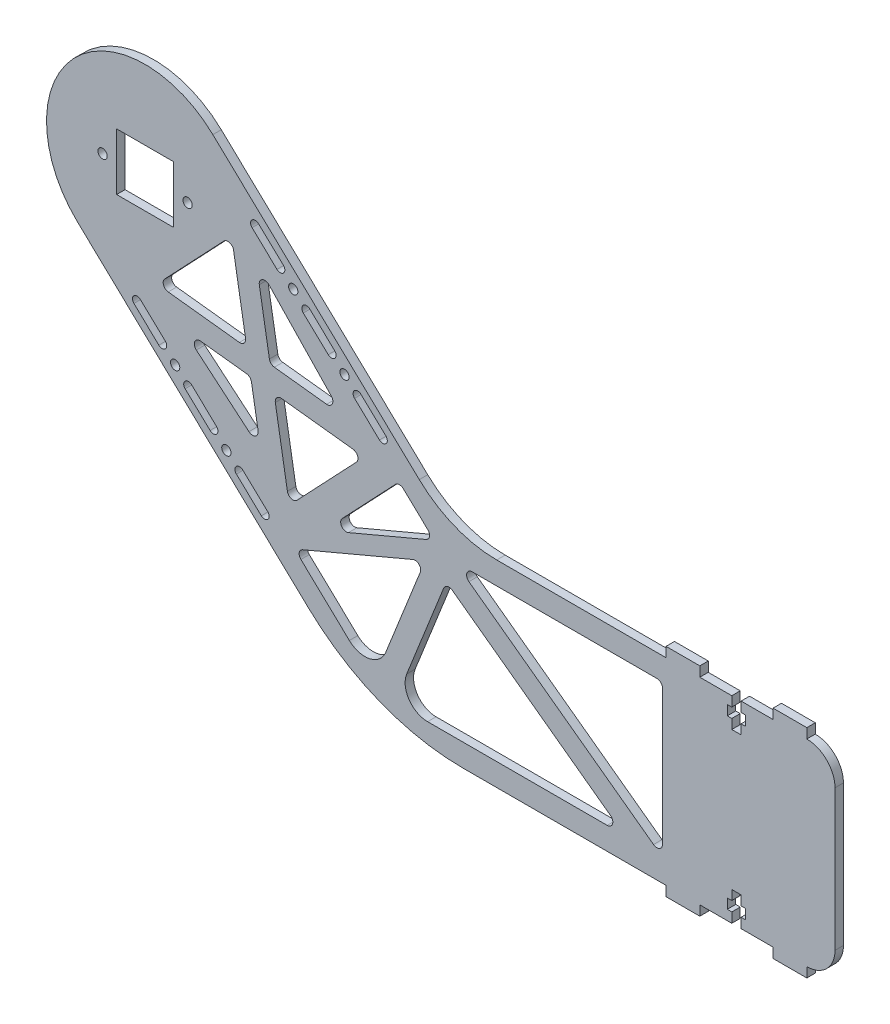
from build123d import *

# Parameters (mm, degrees)
SKETCH_1_R          = 7.65
EXTRUDE_1_DEPTH     = 3
FILLET_1_R          = 10
SKETCH_3_R          = 1.65
CUT_EXTRUDE_2_DEPTH = 276.061811235
FILLET_2_R          = 40
FILLET_3_R          = 80
SKETCH_4_W          = 12
SKETCH_4_H          = 3.5
EXTRUDE_2_DEPTH     = 3
CUT_EXTRUDE_3_DEPTH = 10
FILLET_4_R          = 2
FILLET_5_R          = 8
SKETCH_6_R          = 1.65
SKETCH_6_W          = 20.2
SKETCH_6_H          = 20.2
CUT_EXTRUDE_4_DEPTH = 277.6699297


with BuildPart() as part:
    # 草图1 → 凸台-拉伸1 (new body)
    with BuildSketch(Plane.XY):
        with BuildLine():
            Line((108.946536832, -55), (24.071062677, 25.408343937))
            ThreePointArc((24.071062677, 25.408343937), (-25.408343937, 24.071062677), (-24.071062677, -25.408343937))
            Line((-24.071062677, -25.408343937), (81.053463168, -125))
            Line((81.053463168, -125), (245, -125))
            Line((245, -125), (245, -55))
            Line((245, -55), (108.946536832, -55))
        make_face()
        Circle(SKETCH_1_R, mode=Mode.SUBTRACT)
    extrude(amount=EXTRUDE_1_DEPTH)

    # 圆角1
    fillet_1_edges = [part.edges().sort_by_distance(p)[0] for p in [
        (245, -55, 1.5),
        (245, -125, 1.5),
    ]]
    fillet(fillet_1_edges, radius=FILLET_1_R)

    # 草图3 → 切除-拉伸2 (cut, through all)
    with BuildSketch(Plane.XY.offset(3)):
        with Locations((10.675325257, -52.127223508)):
            Circle(SKETCH_3_R)
        with Locations((52.62774878, -7.84410979)):
            Circle(SKETCH_3_R)
        with Locations((70.824604166, -24.986876604)):
            Circle(SKETCH_3_R)
        with Locations((28.872180643, -69.269990322)):
            Circle(SKETCH_3_R)
        with BuildLine():
            Line((40.259807528, 6.14576259), (49.116430272, -2.244722115))
            ThreePointArc((49.116430272, -2.244722115), (49.179473531, -4.577322712), (46.846872934, -4.640365972))
            Line((46.846872934, -4.640365972), (37.99025019, 3.750118733))
            ThreePointArc((37.99025019, 3.750118733), (37.92720693, 6.08271933), (40.259807528, 6.14576259))
        make_face()
        with BuildLine():
            Line((16.504239392, -55.280117943), (25.360862135, -63.670602647))
            ThreePointArc((25.360862135, -63.670602647), (25.423905395, -66.003203245), (23.091304797, -66.066246504))
            Line((23.091304797, -66.066246504), (14.234682054, -57.6757618))
            ThreePointArc((14.234682054, -57.6757618), (14.171638794, -55.343161202), (16.504239392, -55.280117943))
        make_face()
        Polygon((208.35, -55), (208.35, -58.5), (206.75, -58.5), (206.75, -62), (208.35, -62), (208.35, -65.4), (211.65, -65.4), (211.65, -62), (213.25, -62), (213.25, -58.5), (211.65, -58.5), (211.65, -55), align=None)
        with BuildLine():
            Line((-1.692615995, -38.137351128), (7.164006749, -46.527835833))
            ThreePointArc((7.164006749, -46.527835833), (7.227050008, -48.86043643), (4.894449411, -48.92347969))
            Line((4.894449411, -48.92347969), (-3.962173333, -40.532994985))
            ThreePointArc((-3.962173333, -40.532994985), (-4.025216592, -38.200394388), (-1.692615995, -38.137351128))
        make_face()
        with BuildLine():
            Line((58.456662914, -10.997004225), (67.313285658, -19.387488929))
            ThreePointArc((67.313285658, -19.387488929), (67.376328917, -21.720089527), (65.04372832, -21.783132786))
            Line((65.04372832, -21.783132786), (56.187105576, -13.392648081))
            ThreePointArc((56.187105576, -13.392648081), (56.124062317, -11.060047484), (58.456662914, -10.997004225))
        make_face()
        with BuildLine():
            Line((34.701094778, -72.422884757), (43.557717522, -80.813369462))
            ThreePointArc((43.557717522, -80.813369462), (43.620760781, -83.145970059), (41.288160183, -83.209013319))
            Line((41.288160183, -83.209013319), (32.43153744, -74.818528614))
            ThreePointArc((32.43153744, -74.818528614), (32.36849418, -72.485928017), (34.701094778, -72.422884757))
        make_face()
        with BuildLine():
            Line((76.6535183, -28.139771039), (85.510141044, -36.530255744))
            ThreePointArc((85.510141044, -36.530255744), (85.573184303, -38.862856341), (83.240583706, -38.9258996))
            Line((83.240583706, -38.9258996), (74.383960962, -30.535414896))
            ThreePointArc((74.383960962, -30.535414896), (74.320917703, -28.202814298), (76.6535183, -28.139771039))
        make_face()
        Polygon((208.35, -125), (211.65, -125), (211.65, -121.5), (213.25, -121.5), (213.25, -118), (211.65, -118), (211.65, -114.6), (208.35, -114.6), (208.35, -118), (206.75, -118), (206.75, -121.5), (208.35, -121.5), align=None)
    extrude(amount=-CUT_EXTRUDE_2_DEPTH, mode=Mode.SUBTRACT)

    # 圆角2
    fillet_2_edges = [part.edges().sort_by_distance(p)[0] for p in [
        (108.946536832, -55, 1.5),
    ]]
    fillet(fillet_2_edges, radius=FILLET_2_R)

    # 圆角3
    fillet_3_edges = [part.edges().sort_by_distance(p)[0] for p in [
        (81.053463168, -125, 1.5),
    ]]
    fillet(fillet_3_edges, radius=FILLET_3_R)

    # 草图4 → 凸台-拉伸2 (add)
    with BuildSketch(Plane.XY.offset(3)):
        with Locations((229, -53.25)):
            Rectangle(SKETCH_4_W, SKETCH_4_H)
        with Locations((191, -53.25)):
            Rectangle(SKETCH_4_W, SKETCH_4_H)
        with Locations((191, -126.75)):
            Rectangle(SKETCH_4_W, SKETCH_4_H)
        with Locations((229, -126.75)):
            Rectangle(SKETCH_4_W, SKETCH_4_H)
    extrude(amount=-EXTRUDE_2_DEPTH)

    # 草图5 → 切除-拉伸3 (cut)
    with BuildSketch(Plane.XY.offset(3)):
        Polygon((36.127453438, -34.086875982), (30.735876382, -2.464353083), (4.227694858, -30.445211358), align=None)
        Polygon((41.063366277, -63.036850208), (13.12952951, -39.513402443), (37.527548139, -42.298671213), align=None)
        Polygon((44.40399322, -35.031722698), (69.950424768, -37.948093861), (39.465464045, -6.066403216), align=None)
        Polygon((51.215235175, -74.980823394), (45.804087921, -43.243517929), (77.819635369, -46.898400967), align=None)
        Polygon((102.632901746, -60.038663458), (63.421774999, -76.636422834), (90.255116273, -48.312340378), align=None)
        Polygon((99.509947592, -67.875977962), (53.116905285, -87.513785309), (81.115387776, -114.038663458), align=None)
        Polygon((88.547109373, -117), (107.005723407, -70.676565087), (170.216089142, -117), align=None)
        Polygon((183.75, -117), (110.064623342, -63), (183.75, -63), align=None)
    extrude(amount=-CUT_EXTRUDE_3_DEPTH, mode=Mode.SUBTRACT)

    # 圆角4
    fillet_4_edges = [part.edges().sort_by_distance(p)[0] for p in [
        (51.215235175, -74.980823394, 1.5),
        (45.804087921, -43.243517929, 1.5),
        (77.819635369, -46.898400967, 1.5),
        (102.632901746, -60.038663458, 1.5),
        (63.421774999, -76.636422834, 1.5),
        (90.255116273, -48.312340378, 1.5),
        (69.950424768, -37.948093861, 1.5),
        (44.40399322, -35.031722698, 1.5),
        (39.465464045, -6.066403216, 1.5),
        (41.063366277, -63.036850208, 1.5),
        (13.12952951, -39.513402443, 1.5),
        (37.527548139, -42.298671213, 1.5),
        (183.75, -117, 1.5),
        (110.064623342, -63, 1.5),
        (183.75, -63, 1.5),
        (53.116905285, -87.513785309, 1.5),
        (99.509947592, -67.875977962, 1.5),
        (107.005723407, -70.676565087, 1.5),
        (170.216089142, -117, 1.5),
        (30.735876382, -2.464353083, 1.5),
        (36.127453438, -34.086875982, 1.5),
        (4.227694858, -30.445211358, 1.5),
    ]]
    fillet(fillet_4_edges, radius=FILLET_4_R)

    # 圆角5
    fillet_5_edges = [part.edges().sort_by_distance(p)[0] for p in [
        (81.115387776, -114.038663458, 1.5),
        (88.547109373, -117, 1.5),
    ]]
    fillet(fillet_5_edges, radius=FILLET_5_R)

    # 草图6 → 切除-拉伸4 (cut, through all)
    with BuildSketch(Plane.XY.offset(3)):
        with Locations((-15.1, 0)):
            Circle(SKETCH_6_R)
        with Locations((15.1, 0)):
            Circle(SKETCH_6_R)
        Rectangle(SKETCH_6_W, SKETCH_6_H)
    extrude(amount=-CUT_EXTRUDE_4_DEPTH, mode=Mode.SUBTRACT)


solid = part.part
